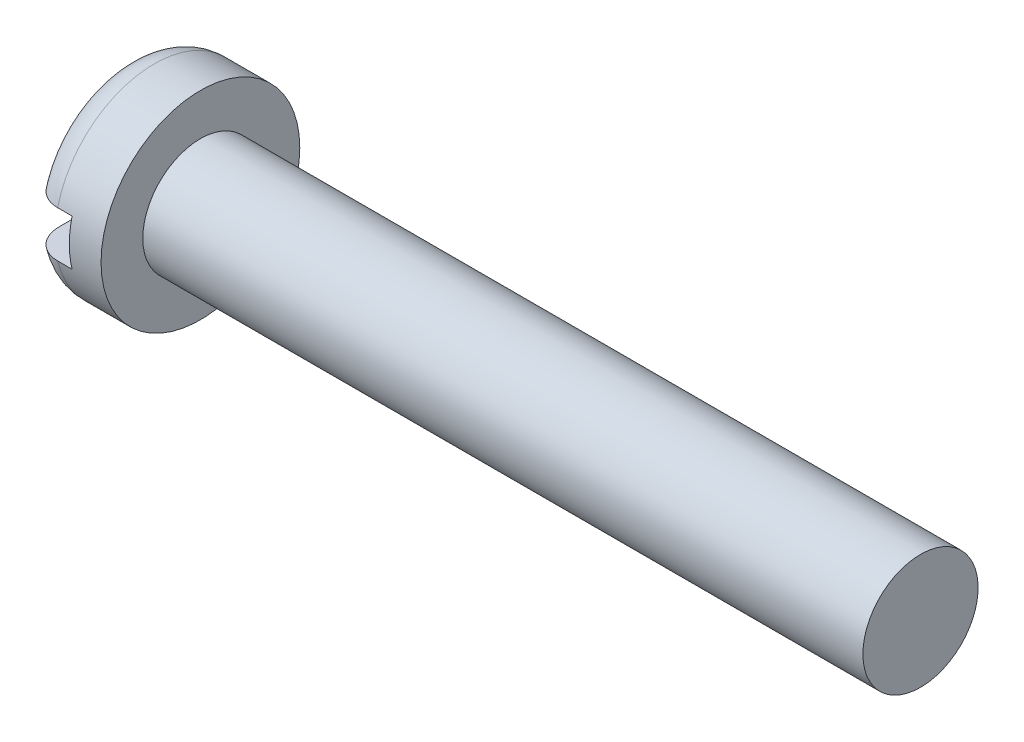
from build123d import *

# Parameters (mm, degrees)
SKETCH2_W  = 6.9
SKETCH2_H  = 1.6
SLOT_DEPTH = 1.5


with BuildPart() as part:
    # BodySke → Base-Revolve (revolve)
    with BuildSketch(Plane.XY, mode=Mode.PRIVATE) as base_revolve_sk:
        with BuildLine():
            Line((2.6, 2), (2.6, 3.45))
            Line((2.6, 3.45), (1, 3.45))
            ThreePointArc((1, 3.45), (0.292893219, 3.157106781), (0, 2.45))
            Line((0, 2.45), (0, 0))
            Line((0, 0), (27.6, 0))
            Line((27.6, 0), (27.6, 2))
            Line((27.6, 2), (2.6, 2))
        make_face()
    revolve(base_revolve_sk.sketch.rotate(Axis((-25.4, 0, 0), (1, 0, 0)), 90), axis=Axis((-25.4, 0, 0), (1, 0, 0)))

    # Sketch2 → Slot (cut)
    with BuildSketch(Plane(origin=(0, 0, 0), x_dir=(0, 0, -1), z_dir=(1, 0, 0))):
        Rectangle(SKETCH2_W, SKETCH2_H)
    extrude(amount=SLOT_DEPTH, mode=Mode.SUBTRACT)


solid = part.part
